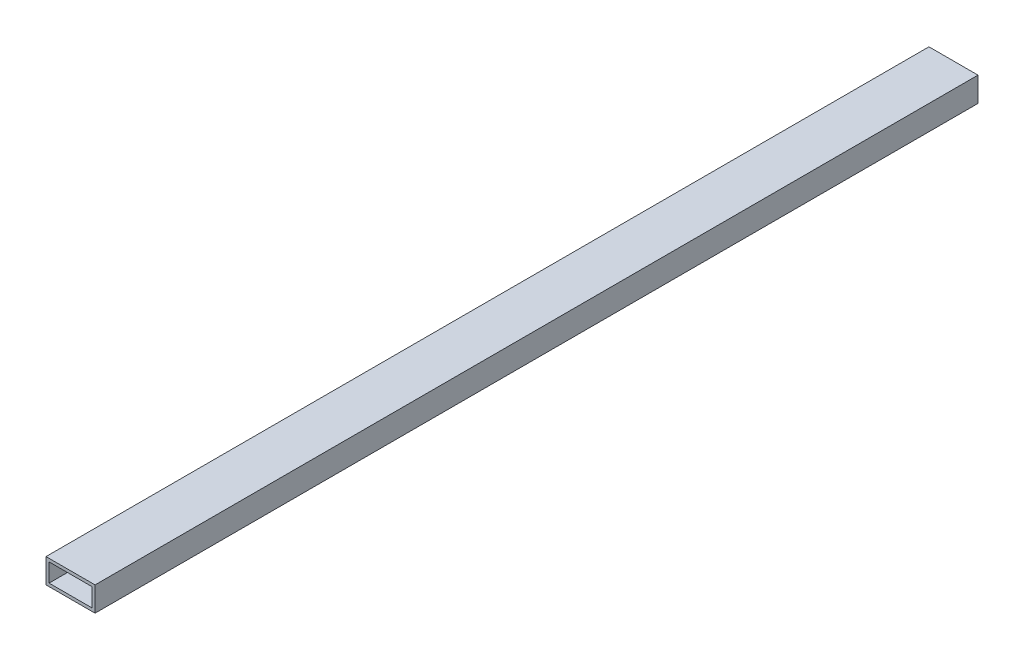
from build123d import *

# Parameters (mm, degrees)
SKETCH1_W           = 50.8
SKETCH1_H           = 25.4
BOSS_EXTRUDE1_DEPTH = 914.4
SHELL1_T            = -3.175


with BuildPart() as part:
    # Sketch1 → Boss-Extrude1 (new body)
    with BuildSketch(Plane.XY):
        Rectangle(SKETCH1_W, SKETCH1_H)
    extrude(amount=BOSS_EXTRUDE1_DEPTH)

    # Shell1
    shell1_openings = [part.faces().sort_by_distance(p)[0] for p in [
        (0, 0, 914.4),
        (0, 0, 0),
    ]]
    offset(amount=SHELL1_T, openings=shell1_openings, kind=Kind.INTERSECTION)


solid = part.part
